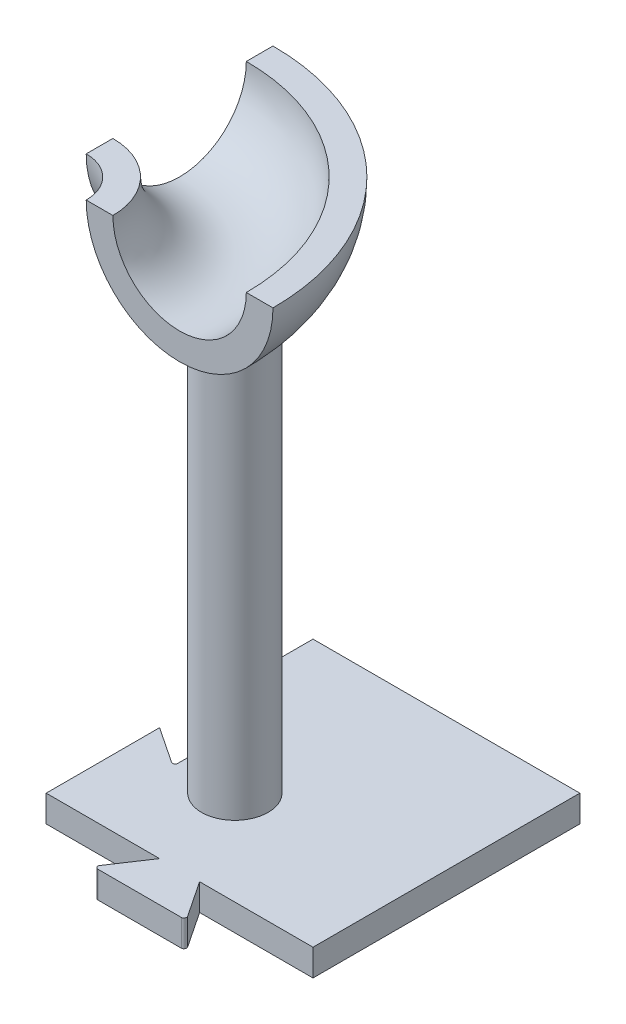
from build123d import *

# Parameters (mm, degrees)
SKETCH1_W                      = 100
SKETCH1_H                      = 100
BOSS_EXTRUDE1_DEPTH            = 10
BOSS_EXTRUDE2_REACH            = 214.132
BOSS_EXTRUDE2_END_MAJOR_RADIUS = 50
BOSS_EXTRUDE2_END_MINOR_RADIUS = 35
SKETCH4_R                      = 12.5
BOSS_EXTRUDE21_DEPTH           = 10
FILLET1_R                      = 1
CUT_EXTRUDE1_REACH             = 230.031
FILLET11_R                     = 1


with BuildPart() as part:
    # Sketch1 → Boss-Extrude1 (new body)
    with BuildSketch(Plane(origin=(0, 0, 0), x_dir=(1, 0, 0), z_dir=(0, 1, 0))):
        Rectangle(SKETCH1_W, SKETCH1_H)
    extrude(amount=BOSS_EXTRUDE1_DEPTH)



with BuildPart() as body_2:
    # Sweep1: sweep along a path in Sketch2
    with BuildLine(Plane(origin=(0, 210, 0), x_dir=(1, 0, 0), z_dir=(0, 1, 0))) as sweep1_path:
        ThreePointArc((0, -50), (-14.644660941, -14.644660941), (-50, 0))
    # Sketch3 → Sweep1 (sweep)
    with BuildSketch(Plane.XY.offset(50)):
        with BuildLine():
            Line((25, 210), (35, 210))
            ThreePointArc((35, 210), (0, 175), (-35, 210))
            Line((-35, 210), (-25, 210))
            ThreePointArc((-25, 210), (0, 185), (25, 210))
        make_face()
    sweep(path=sweep1_path.line)


with BuildPart() as part_1:
    add(part.part)

    add(body_2.part)  # Boss-Extrude2 merges body 2
    # Boss-Extrude2: up to this torus (the profile starts outside it)
    boss_extrude2_end = Plane(origin=(-50, 210, 50), z_dir=(0, 1, 0)) * Torus(BOSS_EXTRUDE2_END_MAJOR_RADIUS, BOSS_EXTRUDE2_END_MINOR_RADIUS, mode=Mode.PRIVATE)
    # Sketch4 → Boss-Extrude2 (add, up to the surface)
    with BuildSketch(Plane(origin=(0, 10, 0), x_dir=(1, 0, 0), z_dir=(0, 1, 0)), mode=Mode.PRIVATE) as boss_extrude2_sk1:
        with Locations(Location((-14.644660941, -14.644660941, 0), (0, 0, 134.571678601))):
            Circle(SKETCH4_R)
    boss_extrude2_tool1 = extrude(boss_extrude2_sk1.sketch, amount=BOSS_EXTRUDE2_REACH, mode=Mode.PRIVATE) - boss_extrude2_end
    add(boss_extrude2_tool1.solids().sort_by_distance((-14.644661, 10, 14.644661))[0])

    # Sketch21 → Boss-Extrude21 (add)
    with BuildSketch(Plane(origin=(14.233580657, 10, 36.500543766), x_dir=(1, 0, 0), z_dir=(0, 1, 0))):
        Polygon((-21.733580657, -13.499456234), (-31.733580657, -28.499456234), (3.266419343, -28.499456234), (-6.733580657, -13.499456234), align=None)
    extrude(amount=-BOSS_EXTRUDE21_DEPTH)

    # Fillet1
    fillet1_edges = [part_1.edges().sort_by_distance(p)[0] for p in [
        (-17.5, 5, 65),
        (17.5, 5, 65),
    ]]
    fillet(fillet1_edges, radius=FILLET1_R)

    # Sketch22 → Cut-Extrude1 (cut, up to next)
    with BuildSketch(Plane(origin=(-40.028558931, 10, 2.604903453), x_dir=(1, 0, 0), z_dir=(0, 1, 0)), mode=Mode.PRIVATE) as cut_extrude1_sk1:
        Polygon((-9.971441069, -4.895096547), (5.028558931, -14.895096547), (5.028558931, 20.104903453), (-9.971441069, 10.104903453), align=None)
    cut_extrude1_tool1 = extrude(cut_extrude1_sk1.sketch, amount=-CUT_EXTRUDE1_REACH, mode=Mode.PRIVATE) & part_1.part
    add(cut_extrude1_tool1.solids().sort_by_distance((-41.5, 10, 0))[0], mode=Mode.SUBTRACT)

    # Fillet11
    fillet11_edges = [part_1.edges().sort_by_distance(p)[0] for p in [
        (-35, 5, -17.5),
        (-35, 5, 17.5),
    ]]
    fillet(fillet11_edges, radius=FILLET11_R)


solid = part_1.part
